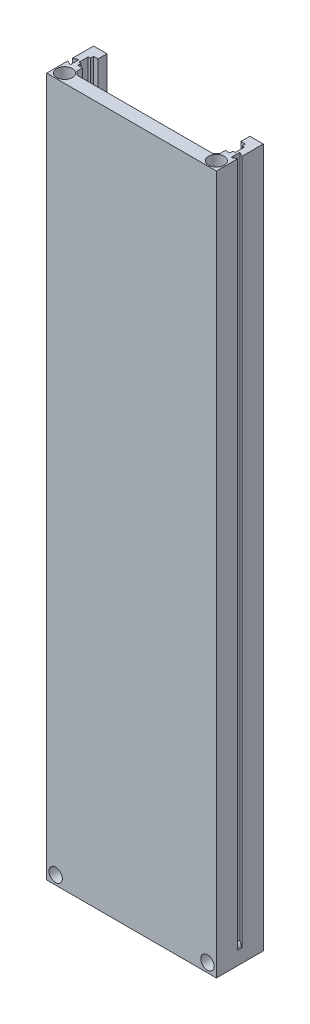
from build123d import *

# Parameters (mm, degrees)
P_IDAT_VYSUNUT_M2_DEPTH        = 3
P_IDAT_VYSUNUT_M2_DEPTH_BACK   = 4.5
SKICA1_W                       = 2
SKICA1_H                       = 153.5
P_IDAT_VYSUNUT_M2_2_DEPTH      = 3
P_IDAT_VYSUNUT_M2_2_DEPTH_BACK = 4.5
SKICA3_W                       = 2
SKICA3_H                       = 153.5
P_IDAT_VYSUNUT_M3_DEPTH        = 1
SKICA5_W                       = 0.5
SKICA5_H                       = 0.3
SKICA5_H_2                     = 1.5
ODEBRAT_VYSUNUT_M2_DEPTH       = 158.729198312
SKICA6_W                       = 1
SKICA6_H                       = 2
P_IDAT_VYSUNUT_M4_DEPTH        = 153.5
SKICA7_W                       = 38
SKICA7_H                       = 153.5
P_IDAT_VYSUNUT_M5_DEPTH        = 3
SKICA8_W                       = 38
SKICA8_H                       = 10.5
P_IDAT_VYSUNUT_M6_DEPTH        = 3
SKICA4_W                       = 0.5
SKICA4_H                       = 0.3
SKICA4_H_2                     = 1.5
ODEBRAT_VYSUNUT_M3_DEPTH       = 158.779117756
ODEBRAT_VYSUNUT_M6_DEPTH       = 153.5
ODEBRAT_START                  = -10.5
SKICA14_R                      = 1.5
ODEBRAT_VYSUNUT_M9_DEPTH       = 10.5
SKICA22_R                      = 2
SKICA22_R_2                    = 1.5
P_IDAT_VYSUNUT_M12_DEPTH       = 10.5
P_IDAT_START                   = -7.5
SKICA15_R                      = 2
SKICA15_R_2                    = 1.75
P_IDAT_VYSUNUT_M7_DEPTH        = 7.5
SKICA16_R                      = 1.75
ODEBRAT_VYSUNUT_M10_DEPTH      = 4
SKICA17_R                      = 2
SKICA17_R_2                    = 1.75
P_IDAT_VYSUNUT_M10_DEPTH       = 4
P_IDAT_VYSUNUT_M11_DEPTH       = 2


with BuildPart() as part:
    # Skica1 → Přidat vysunutím2 (new, two sides: drawn at the far end of the back side and taken through both)
    with BuildSketch(Plane.XY.offset(-P_IDAT_VYSUNUT_M2_DEPTH_BACK)):
        with Locations((1, 74.75)):
            Rectangle(SKICA1_W, SKICA1_H)
    extrude(amount=P_IDAT_VYSUNUT_M2_DEPTH + P_IDAT_VYSUNUT_M2_DEPTH_BACK)

    # Skica3 → Přidat vysunutím3 (add)
    with BuildSketch(Plane.ZY):
        with Locations((-3.5, 74.75)):
            Rectangle(SKICA3_W, SKICA3_H)
        with Locations((2, 74.75)):
            Rectangle(SKICA3_W, SKICA3_H)
    extrude(amount=P_IDAT_VYSUNUT_M3_DEPTH)



with BuildPart() as body_2:
    # Skica1 → P_idat vysunut_m2 2 (new, two sides: drawn at the far end of the back side and taken through both)
    with BuildSketch(Plane.XY.offset(-P_IDAT_VYSUNUT_M2_2_DEPTH_BACK)):
        with Locations((-35, 74.75)):
            Rectangle(SKICA1_W, SKICA1_H)
    extrude(amount=P_IDAT_VYSUNUT_M2_2_DEPTH + P_IDAT_VYSUNUT_M2_2_DEPTH_BACK)

    # Skica5 → Odebrat vysunutím2 (cut, through all)
    with BuildSketch(Plane.XZ.offset(2)):
        with Locations((-34.25, -1.65)):
            Rectangle(SKICA5_W, SKICA5_H)
        with Locations((-34.25, -0.75)):
            Rectangle(SKICA5_W, SKICA5_H_2)
        with Locations((-34.25, 0.15)):
            Rectangle(SKICA5_W, SKICA5_H)
    extrude(amount=-ODEBRAT_VYSUNUT_M2_DEPTH, mode=Mode.SUBTRACT)

    # Skica6 → Přidat vysunutím4 (add, through all)
    with BuildSketch(Plane.XZ.offset(2)):
        with Locations((-33.5, 2)):
            Rectangle(SKICA6_W, SKICA6_H)
        with Locations((-33.5, -3.5)):
            Rectangle(SKICA6_W, SKICA6_H)
    extrude(amount=-P_IDAT_VYSUNUT_M4_DEPTH)


with BuildPart() as part_1:
    add(part.part)

    add(body_2.part)  # Přidat vysunutím5 merges body 2
    # Skica7 → Přidat vysunutím5 (add)
    with BuildSketch(Plane.XY.offset(3)):
        with Locations((-17, 74.75)):
            Rectangle(SKICA7_W, SKICA7_H)
    extrude(amount=P_IDAT_VYSUNUT_M5_DEPTH)

    # Skica8 → Přidat vysunutím6 (add)
    with BuildSketch(Plane.XZ.offset(2)):
        with Locations((-17, 0.75)):
            Rectangle(SKICA8_W, SKICA8_H)
    extrude(amount=P_IDAT_VYSUNUT_M6_DEPTH)

    # Skica4 → Odebrat vysunutím3 (cut, through all)
    with BuildSketch(Plane.XZ.offset(2)):
        with Locations((0.25, 0.15)):
            Rectangle(SKICA4_W, SKICA4_H)
        with Locations((0.25, -0.75)):
            Rectangle(SKICA4_W, SKICA4_H_2)
        with Locations((0.25, -1.65)):
            Rectangle(SKICA4_W, SKICA4_H)
    extrude(amount=-ODEBRAT_VYSUNUT_M3_DEPTH, mode=Mode.SUBTRACT)

    # Skica11 → Odebrat vysunutím6 (cut)
    with BuildSketch(Plane(origin=(-33, -2, 3), x_dir=(1, 0, 0), z_dir=(0, -1, 0))):
        Polygon((-2, -1.25), (-2, -3.25), (-3, -2.75), (-3, -1.75), align=None)
        Polygon((34, -1.25), (35, -1.75), (35, -2.75), (34, -3.25), align=None)
    extrude(amount=-ODEBRAT_VYSUNUT_M6_DEPTH, mode=Mode.SUBTRACT)

    # Skica14 → Odebrat vysunutím9 (cut)
    with BuildSketch(Plane(origin=(0, 0, -4.5), x_dir=(-1, 0, 0), z_dir=(0, 0, -1)).offset(ODEBRAT_START)):
        with Locations((34, -3)):
            Circle(SKICA14_R)
        with Locations(Location((0, -3, 0), (0, 0, 41.810314896))):
            Circle(SKICA14_R)
    extrude(amount=ODEBRAT_VYSUNUT_M9_DEPTH, mode=Mode.SUBTRACT)

    # Skica22 → Přidat vysunutím12 (add)
    # profile 1 of 2: a face of its own
    with BuildSketch(Plane.XY.offset(6)):
        with Locations((-34, -3)):
            Circle(SKICA22_R)
        with Locations(Location((-34, -3, 0), (0, 0, 180))):
            Circle(SKICA22_R_2, mode=Mode.SUBTRACT)
    # profile 2 of 2: a face of its own
    with BuildSketch(Plane.XY.offset(6)):
        with Locations((0, -3)):
            Circle(SKICA22_R)
        with Locations((0, -3)):
            Circle(SKICA22_R_2, mode=Mode.SUBTRACT)
    extrude(amount=-P_IDAT_VYSUNUT_M12_DEPTH)

    # Skica15 → Přidat vysunutím7 (add)
    # profile 1 of 2: a face of its own
    with BuildSketch(Plane(origin=(0, 0, -4.5), x_dir=(-1, 0, 0), z_dir=(0, 0, -1)).offset(P_IDAT_START)):
        with Locations((34, -3)):
            Circle(SKICA15_R)
        with Locations((34, -3)):
            Circle(SKICA15_R_2, mode=Mode.SUBTRACT)
    # profile 2 of 2: a face of its own
    with BuildSketch(Plane(origin=(0, 0, -4.5), x_dir=(-1, 0, 0), z_dir=(0, 0, -1)).offset(P_IDAT_START)):
        with Locations((0, -3)):
            Circle(SKICA15_R)
        with Locations((0, -3)):
            Circle(SKICA15_R_2, mode=Mode.SUBTRACT)
    extrude(amount=P_IDAT_VYSUNUT_M7_DEPTH)

    # Skica16 → Odebrat vysunutím10 (cut)
    with BuildSketch(Plane(origin=(0, 151.5, 0), x_dir=(1, 0, 0), z_dir=(0, 1, 0))):
        with Locations((0, -4)):
            Circle(SKICA16_R)
        with Locations((-34, -4)):
            Circle(SKICA16_R)
    extrude(amount=-ODEBRAT_VYSUNUT_M10_DEPTH, mode=Mode.SUBTRACT)

    # Skica17 → Přidat vysunutím10 (add)
    # profile 1 of 2: a face of its own
    with BuildSketch(Plane(origin=(0, 151.5, 0), x_dir=(1, 0, 0), z_dir=(0, 1, 0))):
        with Locations((0, -4)):
            Circle(SKICA17_R)
        with Locations(Location((0, -4, 0), (0, 0, 270))):
            Circle(SKICA17_R_2, mode=Mode.SUBTRACT)
    # profile 2 of 2: a face of its own
    with BuildSketch(Plane(origin=(0, 151.5, 0), x_dir=(1, 0, 0), z_dir=(0, 1, 0))):
        with Locations((-34, -4)):
            Circle(SKICA17_R)
        with Locations(Location((-34, -4, 0), (0, 0, 34.849904579))):
            Circle(SKICA17_R_2, mode=Mode.SUBTRACT)
    extrude(amount=-P_IDAT_VYSUNUT_M10_DEPTH)

    # Skica18 → Přidat vysunutím11 (add)
    with BuildSketch(Plane.XZ.offset(-147.5)):
        with BuildLine():
            Line((-33, 2.267949192), (-33, 3))
            Line((-33, 3), (-32.267949192, 3))
            ThreePointArc((-32.267949192, 3), (-32.48236191, 2.48236191), (-33, 2.267949192))
        make_face()
        with BuildLine():
            Line((-1.732050808, 3), (-1, 3))
            Line((-1, 3), (-1, 2.267949192))
            ThreePointArc((-1, 2.267949192), (-1.51763809, 2.48236191), (-1.732050808, 3))
        make_face()
    extrude(amount=P_IDAT_VYSUNUT_M11_DEPTH)


solid = part_1.part
